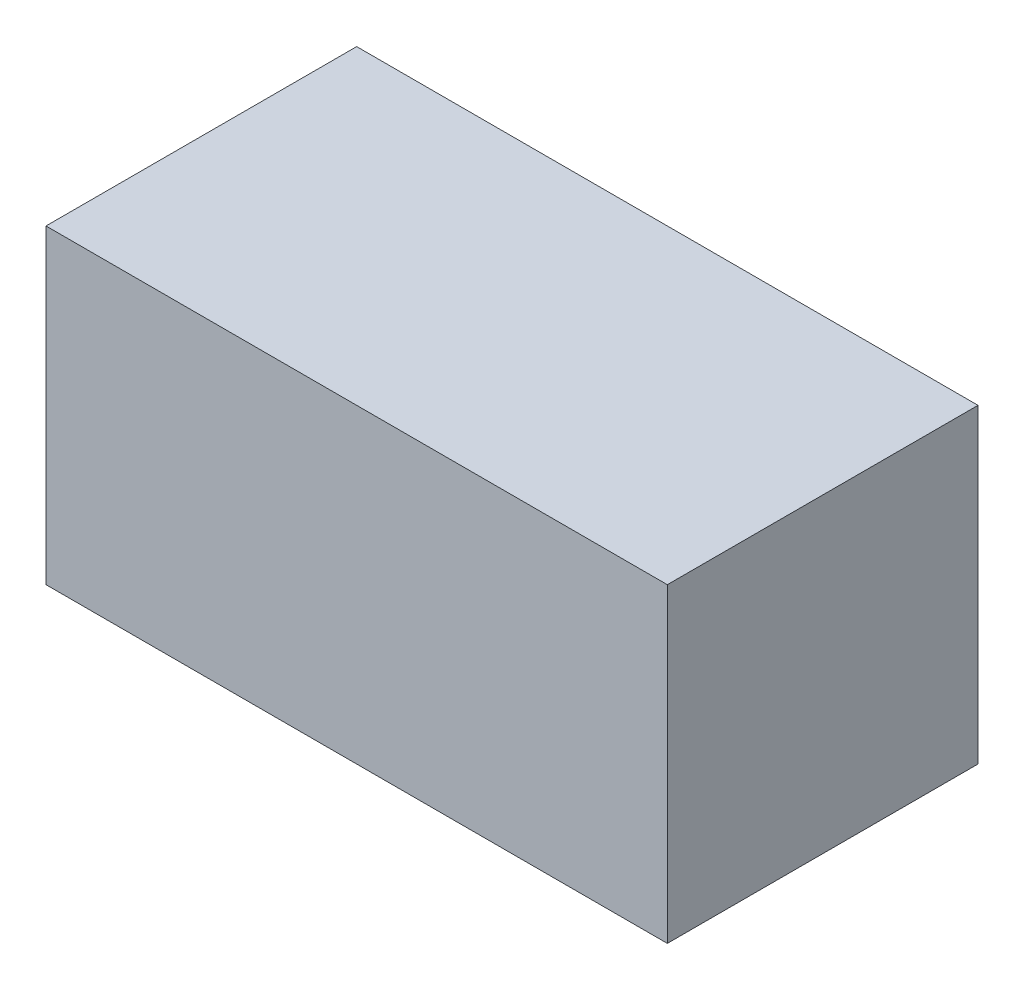
from build123d import *

# Parameters (mm, degrees)
SKETCH1_W      = 12.7
SKETCH1_H      = 6.35
EXTRUDE1_DEPTH = 6.35


with BuildPart() as part:
    # Sketch1 → Extrude1 (new body)
    with BuildSketch(Plane.XY):
        Rectangle(SKETCH1_W, SKETCH1_H)
    extrude(amount=EXTRUDE1_DEPTH)


solid = part.part
